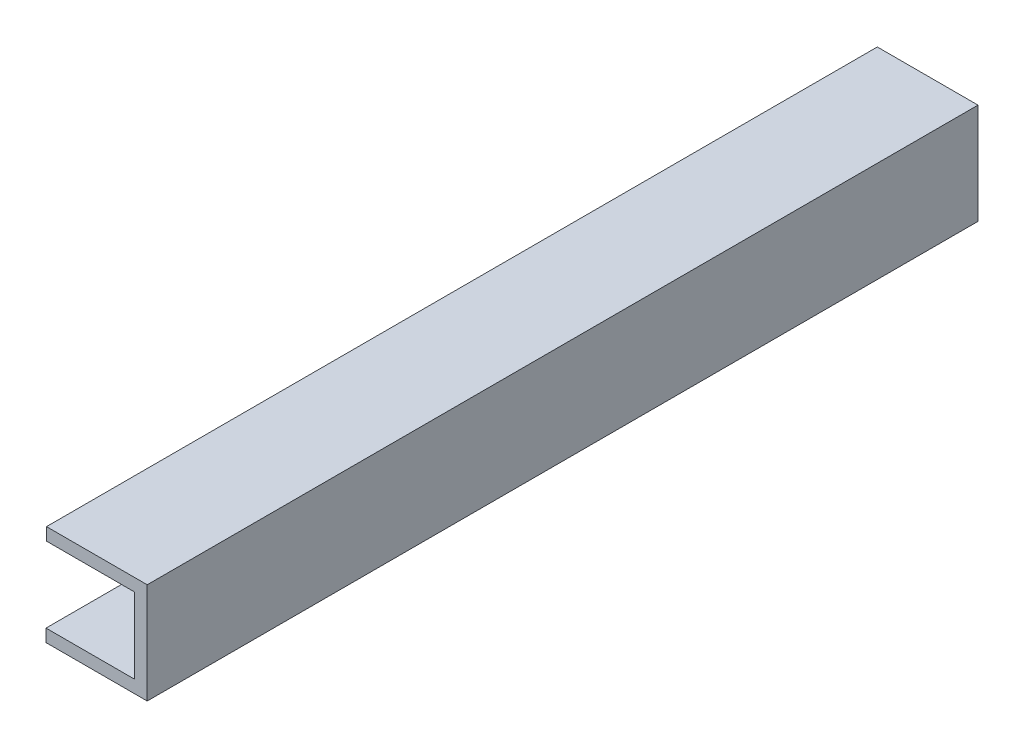
from build123d import *

# Parameters (mm, degrees)
BOSS_EXTRUDE2_DEPTH = 209.55


with BuildPart() as part:
    # Sketch1 → Boss-Extrude2 (new body)
    with BuildSketch(Plane.XY):
        Polygon((-35.931581634, 6.840435924), (-35.931581634, 3.665435924), (-13.706581634, 3.665435924), (-13.706581634, -15.384564076), (-36.058581634, -15.384564076), (-36.058581634, -18.559564076), (-10.531581634, -18.559564076), (-10.531581634, 6.840435924), align=None)
    extrude(amount=BOSS_EXTRUDE2_DEPTH)


solid = part.part
